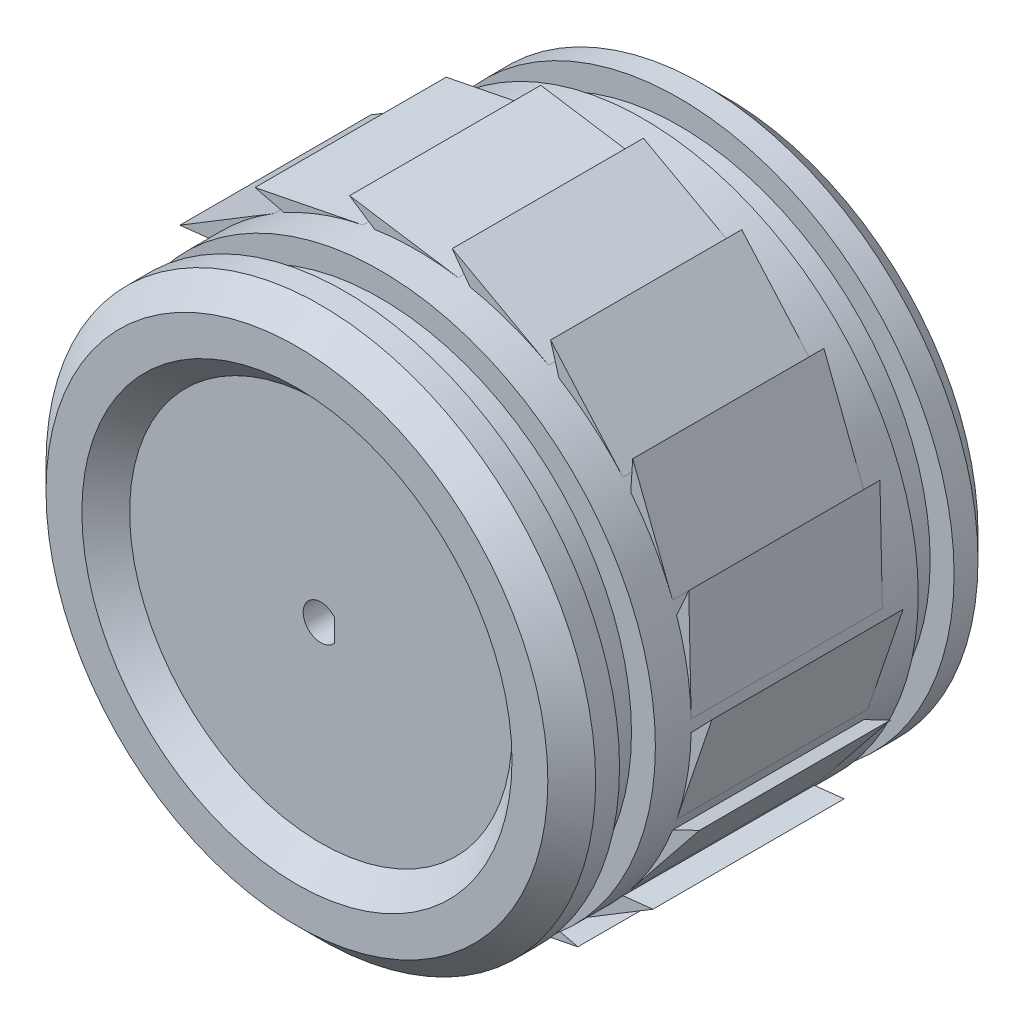
from build123d import *

# Parameters (mm, degrees)
CUT_EXTRUDE_1_DEPTH = 48.053161424
EXTRUDE_1_DEPTH     = 8


with BuildPart() as part:
    # Эскиз1 → Повернуть1 (revolve)
    with BuildSketch(Plane(origin=(0, 0, 0), x_dir=(0, 0, -1), z_dir=(1, 0, 0))):
        with BuildLine():
            Line((16, 23), (0, 23))
            Line((0, 23), (-16, 23))
            Line((-16, 23), (-18, 21))
            Line((-18, 21), (-18, 18))
            Line((-18, 18), (-16, 16))
            Line((-16, 16), (-16, 0))
            Line((-16, 0), (-14.334262465, 0))
            Line((-14.334262465, 0), (-6, 0))
            Line((-6, 0), (-6, 3.080332822))
            add(Edge.make_bspline(
                [(-12, 10), (-11.479779, 10), (-6.662031501, 9.444141655), (-6, 4.094482088), (-6, 3.080332822)],
                knots=[0, 0, 0, 0, 0.356150799, 1, 1, 1, 1], degree=3))
            Line((-12, 10), (-12, 13.5))
            Line((-12, 13.5), (-8, 17.5))
            Line((-8, 17.5), (18, 17.5))
            Line((18, 17.5), (18, 21))
            Line((18, 21), (16, 23))
        make_face()
    revolve(axis=Axis((0, 0, 28.673920663), (0, 0, -1)))

    # Эскиз2 → Вырез-Вытянуть1 (cut, through all)
    with BuildSketch(Plane.XY.offset(16)):
        with BuildLine():
            Line((1.125, -0.953939201), (1.125, 0.953939201))
            ThreePointArc((1.125, 0.953939201), (-1.475, 0), (1.125, -0.953939201))
        make_face()
    extrude(amount=-CUT_EXTRUDE_1_DEPTH, mode=Mode.SUBTRACT)

    # Эскиз3 → Вырез-Повернуть1 (revolve, cut)
    with BuildSketch(Plane(origin=(0, 0, 0), x_dir=(0, 0, -1), z_dir=(1, 0, 0))):
        Polygon((18, 21), (16, 23), (14, 23), (14, 21), (11, 21), (11, 23), (-11, 23), (-11, 21), (-14, 21), (-14, 23), (-16, 23), (-18, 21), (-18, 24.334722486), (18, 24.334722486), align=None)
    revolve(axis=Axis((0, 0, 27.637589676), (0, 0, -1)), mode=Mode.SUBTRACT)

    # Эскиз4 → Бобышка-Вытянуть1 (add, symmetric)
    with BuildSketch(Plane.XY):
        with BuildLine():
            Line((-3.5, 22.732135843), (-5.592854337, 24.132135843))
            Line((-5.592854337, 24.132135843), (3.5, 22.732135843))
            ThreePointArc((3.5, 22.732135843), (0, 23), (-3.5, 22.732135843))
        make_face()
        with BuildLine():
            Line((2.99811261, 24.589658818), (11.063772532, 20.164149805))
            ThreePointArc((11.063772532, 20.164149805), (7.866463296, 21.612930278), (4.485924186, 22.558290808))
            Line((4.485924186, 22.558290808), (2.99811261, 24.589658818))
        make_face()
        with BuildLine():
            Line((11.227462929, 22.081306034), (17.293090813, 15.164069709))
            ThreePointArc((17.293090813, 15.164069709), (14.784115023, 17.619022192), (11.930779711, 19.663582977))
            Line((11.930779711, 19.663582977), (11.227462929, 22.081306034))
        make_face()
        with BuildLine():
            Line((18.102615519, 16.909621857), (21.436607123, 8.334979008))
            ThreePointArc((21.436607123, 8.334979008), (19.918584287, 11.5), (17.936607123, 14.397156835))
            Line((17.936607123, 14.397156835), (18.102615519, 16.909621857))
        make_face()
        with BuildLine():
            Line((22.794325512, 9.698387725), (22.994552243, 0.500566828))
            ThreePointArc((22.994552243, 0.500566828), (22.650578319, 3.993908086), (21.779014999, 7.394221099))
            Line((21.779014999, 7.394221099), (22.794325512, 9.698387725))
        make_face()
        with BuildLine():
            Line((24.736703439, 1.3173849), (21.779014999, -7.394221099))
            ThreePointArc((21.779014999, -7.394221099), (22.650578319, -3.993908086), (22.994552243, -0.500566828))
            Line((22.994552243, -0.500566828), (24.736703439, 1.3173849))
        make_face()
        with BuildLine():
            Line((23.695469857, -7.222513986), (17.936607123, -14.397156835))
            ThreePointArc((17.936607123, -14.397156835), (19.918584287, -11.5), (21.436607123, -8.334979008))
            Line((21.436607123, -8.334979008), (23.695469857, -7.222513986))
        make_face()
        with BuildLine():
            Line((19.796212902, -14.891271093), (11.930779711, -19.663582977))
            ThreePointArc((11.930779711, -19.663582977), (14.784115023, -17.619022192), (17.293090813, -15.164069709))
            Line((17.293090813, -15.164069709), (19.796212902, -14.891271093))
        make_face()
        with BuildLine():
            Line((13.50924051, -20.763921134), (4.485924186, -22.558290808))
            ThreePointArc((4.485924186, -22.558290808), (7.866463296, -21.612930278), (11.063772532, -20.164149805))
            Line((11.063772532, -20.164149805), (13.50924051, -20.763921134))
        make_face()
        with BuildLine():
            Line((5.592854337, -24.132135843), (-3.5, -22.732135843))
            ThreePointArc((-3.5, -22.732135843), (0, -23), (3.5, -22.732135843))
            Line((3.5, -22.732135843), (5.592854337, -24.132135843))
        make_face()
        with BuildLine():
            Line((-2.99811261, -24.589658818), (-11.063772532, -20.164149805))
            ThreePointArc((-11.063772532, -20.164149805), (-7.866463296, -21.612930278), (-4.485924186, -22.558290808))
            Line((-4.485924186, -22.558290808), (-2.99811261, -24.589658818))
        make_face()
        with BuildLine():
            Line((-11.227462929, -22.081306034), (-17.293090813, -15.164069709))
            ThreePointArc((-17.293090813, -15.164069709), (-14.784115023, -17.619022192), (-11.930779711, -19.663582977))
            Line((-11.930779711, -19.663582977), (-11.227462929, -22.081306034))
        make_face()
        with BuildLine():
            Line((-18.102615519, -16.909621857), (-21.436607123, -8.334979008))
            ThreePointArc((-21.436607123, -8.334979008), (-19.918584287, -11.5), (-17.936607123, -14.397156835))
            Line((-17.936607123, -14.397156835), (-18.102615519, -16.909621857))
        make_face()
        with BuildLine():
            Line((-22.794325512, -9.698387725), (-22.994552243, -0.500566828))
            ThreePointArc((-22.994552243, -0.500566828), (-22.650578319, -3.993908086), (-21.779014999, -7.394221099))
            Line((-21.779014999, -7.394221099), (-22.794325512, -9.698387725))
        make_face()
        with BuildLine():
            Line((-24.736703439, -1.3173849), (-21.779014999, 7.394221099))
            ThreePointArc((-21.779014999, 7.394221099), (-22.650578319, 3.993908086), (-22.994552243, 0.500566828))
            Line((-22.994552243, 0.500566828), (-24.736703439, -1.3173849))
        make_face()
        with BuildLine():
            Line((-23.695469857, 7.222513986), (-17.936607123, 14.397156835))
            ThreePointArc((-17.936607123, 14.397156835), (-19.918584287, 11.5), (-21.436607123, 8.334979008))
            Line((-21.436607123, 8.334979008), (-23.695469857, 7.222513986))
        make_face()
        with BuildLine():
            Line((-19.796212902, 14.891271093), (-11.930779711, 19.663582977))
            ThreePointArc((-11.930779711, 19.663582977), (-14.784115023, 17.619022192), (-17.293090813, 15.164069709))
            Line((-17.293090813, 15.164069709), (-19.796212902, 14.891271093))
        make_face()
        with BuildLine():
            Line((-13.50924051, 20.763921134), (-4.485924186, 22.558290808))
            ThreePointArc((-4.485924186, 22.558290808), (-7.866463296, 21.612930278), (-11.063772532, 20.164149805))
            Line((-11.063772532, 20.164149805), (-13.50924051, 20.763921134))
        make_face()
    extrude(amount=EXTRUDE_1_DEPTH, both=True)


solid = part.part
